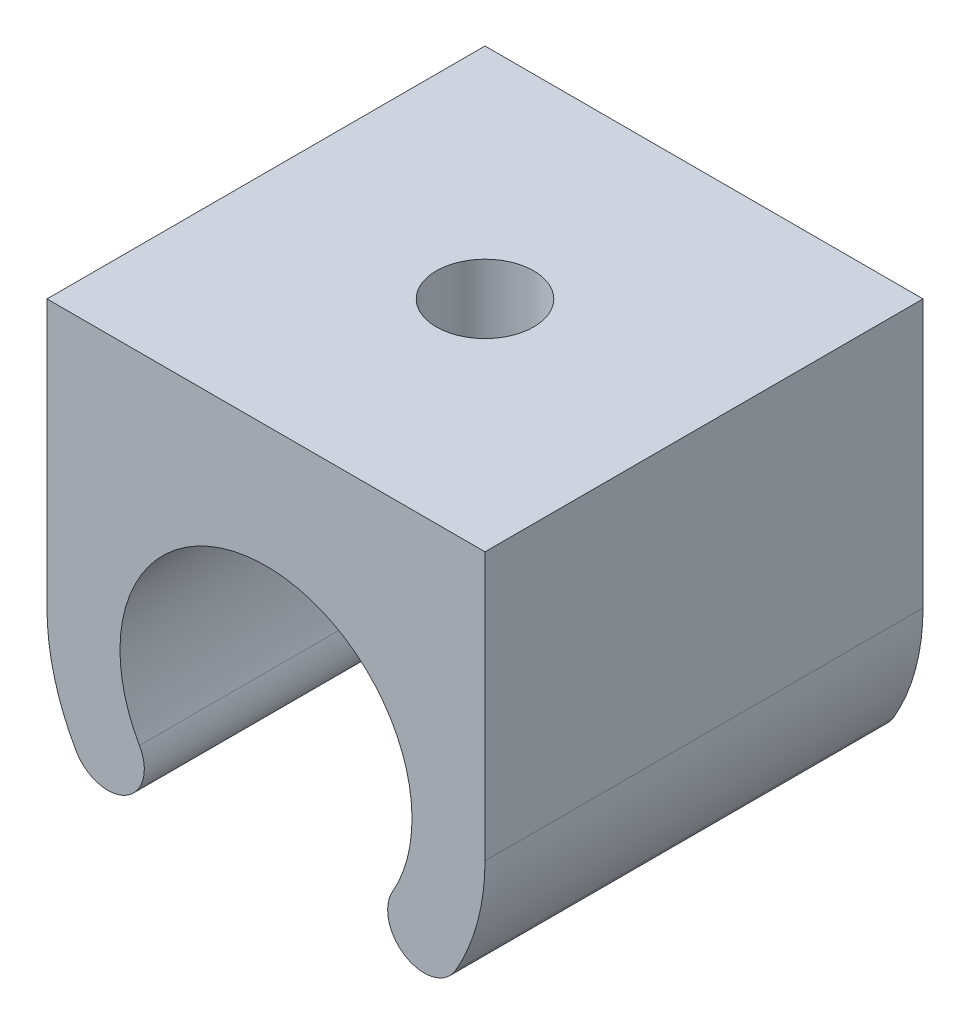
from build123d import *

# Parameters (mm, degrees)
AUFSATZ_LINEAR_AUSTRAGEN1_DEPTH      = 4.5
SCHNITT_LINEAR_AUSTRAGEN1_REACH      = 12.317
SCHNITT_LINEAR_AUSTRAGEN1_END_RADIUS = 3
SKIZZE3_R                            = 1


with BuildPart() as part:
    # Skizze1 → Aufsatz-Linear austragen1 (new, symmetric)
    with BuildSketch(Plane.XY):
        with BuildLine():
            Line((-4.5, 5.5), (4.5, 5.5))
            Line((4.5, 5.5), (4.5, 0))
            ThreePointArc((4.5, 0), (4.347413024, -1.161895004), (3.9, -2.244994432))
            ThreePointArc((3.9, -2.244994432), (2.875834261, -2.520828693), (2.6, -1.496662955))
            ThreePointArc((2.6, -1.496662955), (0, 3), (-2.6, -1.496662955))
            ThreePointArc((-2.6, -1.496662955), (-2.875834261, -2.520828693), (-3.9, -2.244994432))
            ThreePointArc((-3.9, -2.244994432), (-4.347413024, -1.161895004), (-4.5, 0))
            Line((-4.5, 0), (-4.5, 5.5))
        make_face()
    extrude(amount=AUFSATZ_LINEAR_AUSTRAGEN1_DEPTH, both=True)

    # Schnitt-Linear austragen1: up to this cylinder (the profile starts outside it)
    schnitt_linear_austragen1_end = Plane(origin=(0, 0, 0), z_dir=(0, 0, -1)) * Cylinder(SCHNITT_LINEAR_AUSTRAGEN1_END_RADIUS, 31.634, mode=Mode.PRIVATE)
    # Skizze3 → Schnitt-Linear austragen1 (cut, up to the surface)
    with BuildSketch(Plane(origin=(0, 5.5, 0), x_dir=(1, 0, 0), z_dir=(0, 1, 0)), mode=Mode.PRIVATE) as schnitt_linear_austragen1_sk1:
        with Locations(Location((0, 0, 0), (0, 0, 270))):
            Circle(SKIZZE3_R)
    schnitt_linear_austragen1_tool1 = extrude(schnitt_linear_austragen1_sk1.sketch, amount=-SCHNITT_LINEAR_AUSTRAGEN1_REACH, mode=Mode.PRIVATE) - schnitt_linear_austragen1_end
    add(schnitt_linear_austragen1_tool1.solids().sort_by_distance((0, 5.5, 0))[0], mode=Mode.SUBTRACT)


solid = part.part
